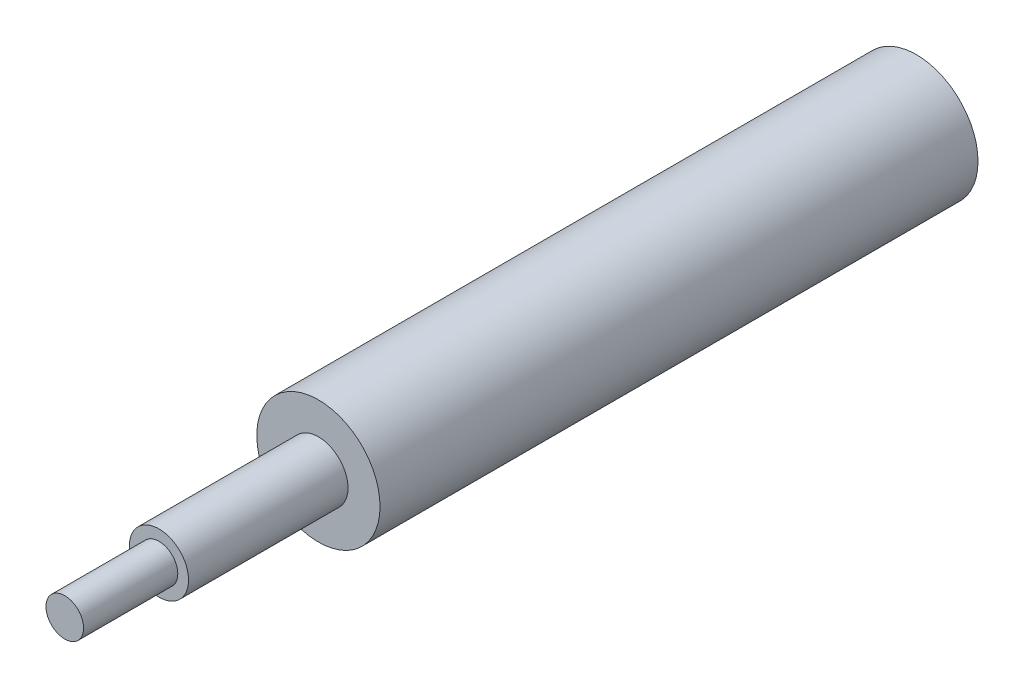
from build123d import *

# Parameters (mm, degrees)
SKETCH1_R           = 9.8171
BOSS_EXTRUDE1_DEPTH = 95.25
SKETCH3_R           = 4.7125
BOSS_EXTRUDE3_DEPTH = 25.4
SKETCH2_R           = 3
BOSS_EXTRUDE2_DEPTH = 15


with BuildPart() as part:
    # Sketch1 → Boss-Extrude1 (new body)
    with BuildSketch(Plane.XY):
        Circle(SKETCH1_R)
    extrude(amount=BOSS_EXTRUDE1_DEPTH)

    # Sketch3 → Boss-Extrude3 (add)
    with BuildSketch(Plane.XY.offset(95.25)):
        Circle(SKETCH3_R)
    extrude(amount=BOSS_EXTRUDE3_DEPTH)

    # Sketch2 → Boss-Extrude2 (add)
    with BuildSketch(Plane.XY.offset(120.65)):
        Circle(SKETCH2_R)
    extrude(amount=BOSS_EXTRUDE2_DEPTH)


solid = part.part
